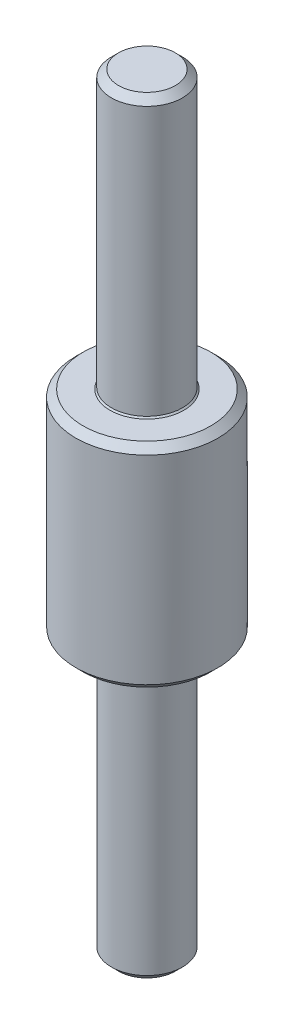
from build123d import *

# Parameters (mm, degrees)
CHAMFER_1_SIZE = 1
CHAMFER_2_SIZE = 0.2


with BuildPart() as part:
    # 草图1 → 旋转1 (revolve)
    with BuildSketch(Plane.XY, mode=Mode.PRIVATE) as revolve_1_sk:
        Polygon((0, 54), (5, 54), (5, 15), (10, 15), (10, -15), (5, -15), (5, -54), (0, -54), align=None)
    revolve(revolve_1_sk.sketch.rotate(Axis((0, 54, 0), (0, -1, 0)), 180), axis=Axis((0, 54, 0), (0, -1, 0)))

    # 倒角1
    chamfer_1_edges = [part.edges().sort_by_distance(p)[0] for p in [
        (5, -54, 0),
        (10, -15, 0),
        (10, 15, 0),
        (5, 54, 0),
    ]]
    chamfer(chamfer_1_edges, length=CHAMFER_1_SIZE)

    # 倒角2
    chamfer_2_edges = [part.edges().sort_by_distance(p)[0] for p in [
        (5, -15, 0),
        (5, 15, 0),
    ]]
    chamfer(chamfer_2_edges, length=CHAMFER_2_SIZE)


solid = part.part
